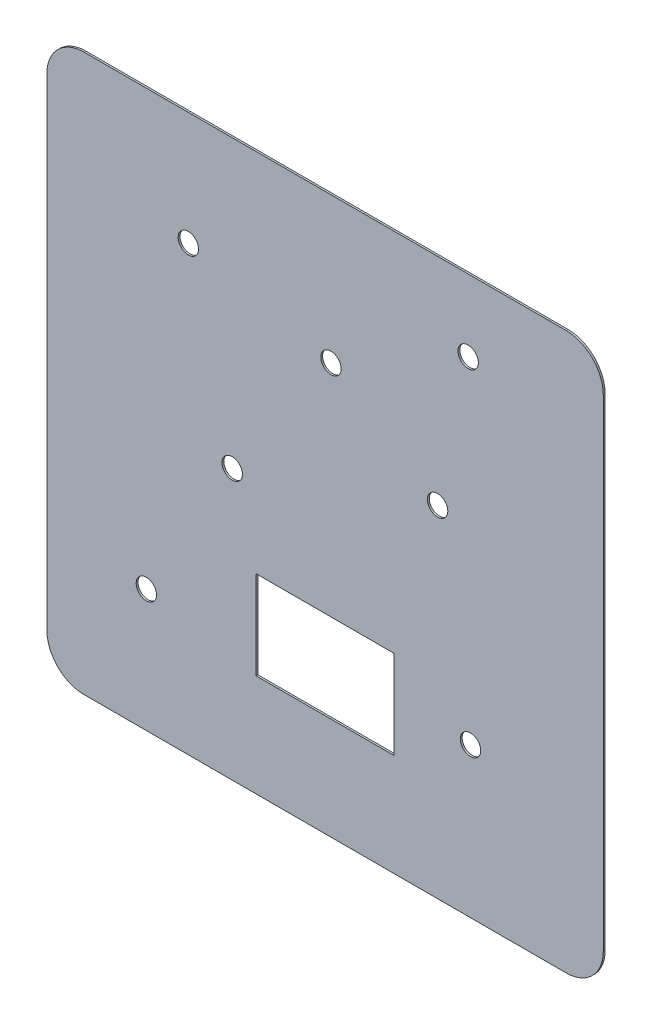
from build123d import *

# Parameters (mm, degrees)
SCHIZZO1_W                   = 150
SCHIZZO1_H                   = 150
ESTRUSIONE_ESTRUSIONE1_DEPTH = 0.5
RACCORDO1_R                  = 10
FORO_PER_VITE_M5_1_D         = 5.5
SCHIZZO3_W                   = 37.184364996
SCHIZZO3_H                   = 23.849136367
TAGLIO_ESTRUSIONE1_DEPTH     = 1


with BuildPart() as part:
    # Schizzo1 → Estrusione-Estrusione1 (new body)
    with BuildSketch(Plane.XY):
        Rectangle(SCHIZZO1_W, SCHIZZO1_H)
    extrude(amount=ESTRUSIONE_ESTRUSIONE1_DEPTH)

    # Raccordo1
    raccordo1_edges = [part.edges().sort_by_distance(p)[0] for p in [
        (75, -75, 0.25),
        (-75, -75, 0.25),
        (-75, 75, 0.25),
        (75, 75, 0.25),
    ]]
    fillet(raccordo1_edges, radius=RACCORDO1_R)

    # Foro per Vite M5-1 (through all)
    with Locations(Plane(origin=(-48.17969376, -41.96615453, 0.5), x_dir=(1, 0, 0), z_dir=(0, 0, 1))):
        with Locations((0, 0), (23.145595818, 39.745135108), (78.516154922, 58.824197627), (87.390661123, 7.359607969), (11.313576068, 86.409501177), (86.764478148, 97.604587147), (49.762627912, 77.691347737)):
            Hole(FORO_PER_VITE_M5_1_D / 2)

    # Schizzo3 → Taglio-Estrusione1 (cut)
    with BuildSketch(Plane.XY.offset(0.5)):
        with Locations((0, -35.505311098)):
            Rectangle(SCHIZZO3_W, SCHIZZO3_H)
    extrude(amount=-TAGLIO_ESTRUSIONE1_DEPTH, mode=Mode.SUBTRACT)


solid = part.part
